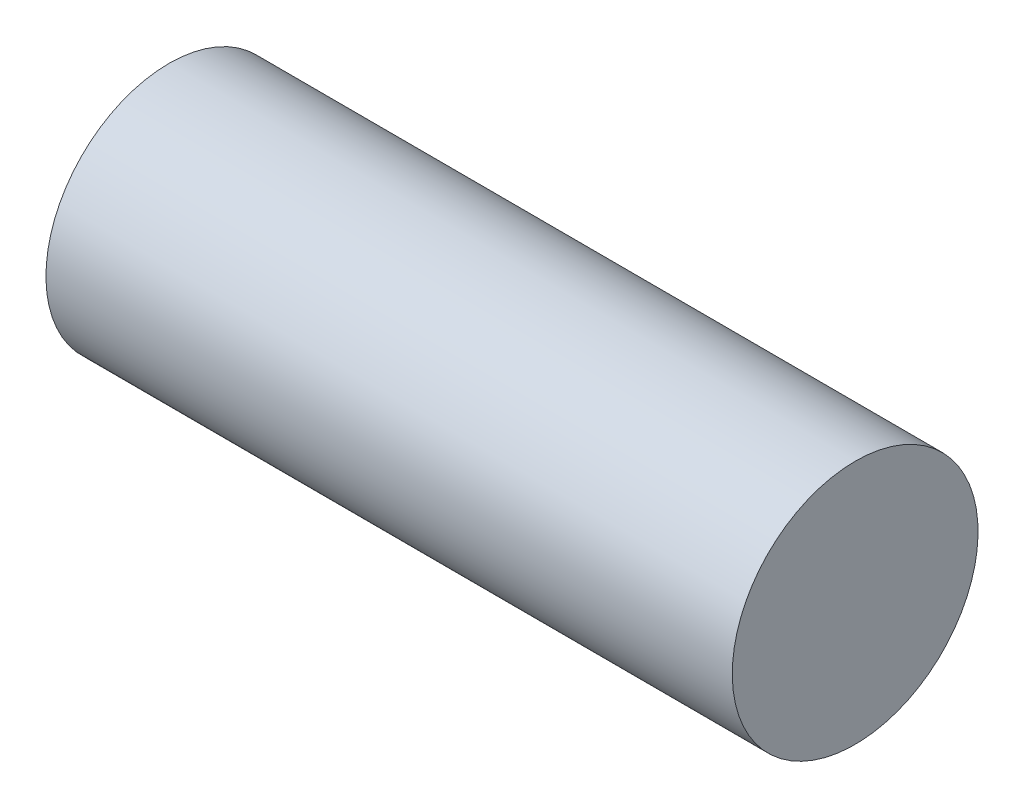
from build123d import *

# Parameters (mm, degrees)
SWEEP1_PROFILE_R = 4.699


with BuildPart() as part:
    # Sweep1: sweep along a curve in space
    with BuildLine() as sweep1_path:
        Line((-13.558042445, 200.895063598, 163.321796861), (12.685805764, 200.845332568, 163.321796809))
    # Sweep1 profile (on start of the path) → Sweep1 (sweep)
    with BuildSketch(Plane(origin=(-13.558042445, 200.895063598, 163.321796861), x_dir=(0.0018949561161686302, 0.9999982045690472, 0), z_dir=(0.9999982045690472, -0.0018949561161686302, -1.9777360692194127e-09))):
        Circle(SWEEP1_PROFILE_R)
    sweep(path=sweep1_path.line)


solid = part.part
